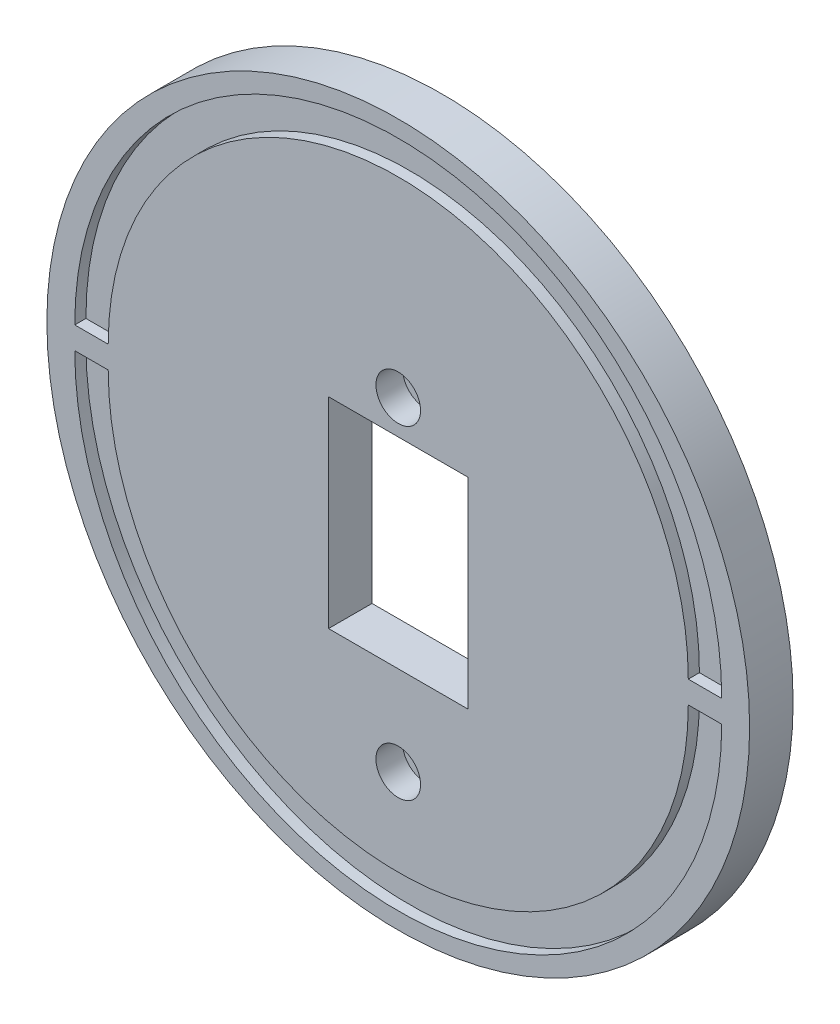
from build123d import *

# Parameters (mm, degrees)
CROQUIS1_R              = 31.5
SALIENTE_EXTRUIR1_DEPTH = 2.4
CROQUIS2_W              = 16.1
CROQUIS2_H              = 36.6
CROQUIS2_W_2            = 12.5
CROQUIS2_H_2            = 33
SALIENTE_EXTRUIR2_DEPTH = 22.5
CROQUIS5_W              = 16.1
CROQUIS5_H              = 36.6
CORTAR_EXTRUIR2_DEPTH   = 9
CROQUIS6_R              = 1.5
CORTAR_EXTRUIR3_DEPTH   = 2.4
CROQUIS7_W              = 12.5
CROQUIS7_H              = 9
SALIENTE_EXTRUIR3_DEPTH = 33
CROQUIS8_R              = 1
CORTAR_EXTRUIR5_DEPTH   = 9
SALIENTE_EXTRUIR4_DEPTH = 12.5
CROQUIS10_W             = 4
CROQUIS10_H             = 2
CORTAR_EXTRUIR6_DEPTH   = 9
CROQUIS11_R             = 31.5
CROQUIS11_W             = 12.5
CROQUIS11_H             = 18
SALIENTE_EXTRUIR5_DEPTH = 3.9
CORTAR_EXTRUIR7_START   = 7
CROQUIS12_R             = 1
CORTAR_EXTRUIR7_DEPTH   = 3.9
CROQUIS13_R             = 2
CORTAR_EXTRUIR8_DEPTH   = 2.4
CROQUIS14_R             = 31.5
CORTAR_EXTRUIR9_DEPTH   = 24.9
CROQUIS15_R             = 31.5
CROQUIS15_R_2           = 2
CROQUIS15_W             = 12.5
CROQUIS15_H             = 18
SALIENTE_EXTRUIR6_DEPTH = 1
CORTAR_EXTRUIR10_DEPTH  = 2
CROQUIS17_R             = 31.5
CORTAR_EXTRUIR11_DEPTH  = 1


with BuildPart() as part:
    # Croquis1 → Saliente-Extruir1 (new body)
    with BuildSketch(Plane.XY):
        with Locations((-51.235671923, 9.786589019)):
            Circle(CROQUIS1_R)
    extrude(amount=SALIENTE_EXTRUIR1_DEPTH)

    # Croquis2 → Saliente-Extruir2 (add)
    with BuildSketch(Plane.XY.offset(2.4)):
        with Locations((-51.235671923, 5.086589019)):
            Rectangle(CROQUIS2_W, CROQUIS2_H)
        with Locations((-51.235671923, 5.086589019)):
            Rectangle(CROQUIS2_W_2, CROQUIS2_H_2, mode=Mode.SUBTRACT)
    extrude(amount=SALIENTE_EXTRUIR2_DEPTH)

    # Croquis5 → Cortar-Extruir2 (cut)
    with BuildSketch(Plane.XY.offset(2.4)):
        with Locations((-51.235671923, 5.086589019)):
            Rectangle(CROQUIS5_W, CROQUIS5_H)
    extrude(amount=-CORTAR_EXTRUIR2_DEPTH, mode=Mode.SUBTRACT)


with BuildPart() as cortar_extruir2_piece_1:
    # of the separate pieces the step leaves, piece 1, a body of its own (cortar_extruir2_pieces)
    add(part.part.solids().sort_by_distance((-19.735671923, 9.786589019, 0))[0])

    # Croquis6 → Cortar-Extruir3 (cut)
    with BuildSketch(Plane(origin=(0, 0, 0), x_dir=(-1, 0, 0), z_dir=(0, 0, -1))):
        with Locations((34.618662565, 26.403598377)):
            Circle(CROQUIS6_R)
        with Locations((67.85268128, 26.403598377)):
            Circle(CROQUIS6_R)
        with Locations((67.85268128, -6.830420339)):
            Circle(CROQUIS6_R)
        with Locations((34.618662565, -6.830420339)):
            Circle(CROQUIS6_R)
        Polygon((51.235671923, 23.386589019), (53.235671923, 23.386589019), (53.235671923, 43.386589019), (49.235671923, 43.386589019), (49.235671923, 23.386589019), align=None)
    extrude(amount=-CORTAR_EXTRUIR3_DEPTH, mode=Mode.SUBTRACT)


with BuildPart() as cortar_extruir2_piece_2:
    # of the separate pieces the step leaves, piece 2, a body of its own (cortar_extruir2_pieces)
    add(part.part.solids().sort_by_distance((-59.285671923, -13.213410981, 24.9))[0])

    # Croquis7 → Saliente-Extruir3 (add)
    with BuildSketch(Plane.XZ.offset(-21.586589019)):
        with Locations((-51.235671923, 13.4)):
            Rectangle(CROQUIS7_W, CROQUIS7_H)
    extrude(amount=SALIENTE_EXTRUIR3_DEPTH)

    # Croquis8 → Cortar-Extruir5 (cut)
    with BuildSketch(Plane.XY.offset(17.9)):
        with Locations((-51.235671923, -9.413410981)):
            Circle(CROQUIS8_R)
        with Locations((-51.235671923, 19.636589019)):
            Circle(CROQUIS8_R)
        Polygon((-44.985671923, -6.413410981), (-57.485671923, -6.413410981), (-57.485671923, 16.586589019), (-53.235671923, 16.586589019), (-53.235671923, 18.586589019), (-49.235671923, 18.586589019), (-49.235671923, 16.586589019), (-44.985671923, 16.586589019), align=None)
    extrude(amount=-CORTAR_EXTRUIR5_DEPTH, mode=Mode.SUBTRACT)

    # Croquis9 → Saliente-Extruir4 (add)
    with BuildSketch(Plane.ZY.offset(44.985671923)):
        Polygon((8.9, -6.413410981), (3.9, -11.413410981), (8.9, -11.413410981), align=None)
        Polygon((8.9, 16.586589019), (3.9, 21.586589019), (8.9, 21.586589019), align=None)
    extrude(amount=SALIENTE_EXTRUIR4_DEPTH)

    # Croquis10 → Cortar-Extruir6 (cut)
    with BuildSketch(Plane.XY.offset(8.9)):
        with Locations((-51.235671923, 17.586589019)):
            Rectangle(CROQUIS10_W, CROQUIS10_H)
    extrude(amount=-CORTAR_EXTRUIR6_DEPTH, mode=Mode.SUBTRACT)

    # Croquis11 → Saliente-Extruir5 (add)
    with BuildSketch(Plane.XY.offset(24.9)):
        with Locations((-51.235671923, 9.786589019)):
            Circle(CROQUIS11_R)
        with Locations((-51.235671923, 7.586589019)):
            Rectangle(CROQUIS11_W, CROQUIS11_H, mode=Mode.SUBTRACT)
    extrude(amount=SALIENTE_EXTRUIR5_DEPTH)

    # Croquis12 → Cortar-Extruir7 (cut)
    with BuildSketch(Plane.XY.offset(17.9).offset(CORTAR_EXTRUIR7_START)):
        with Locations((-51.235671923, 19.636589019)):
            Circle(CROQUIS12_R)
        with Locations((-51.235671923, -9.413410981)):
            Circle(CROQUIS12_R)
    extrude(amount=CORTAR_EXTRUIR7_DEPTH, mode=Mode.SUBTRACT)

    # Croquis13 → Cortar-Extruir8 (cut)
    with BuildSketch(Plane.XY.offset(28.8)):
        with Locations((-51.235671923, 19.636589019)):
            Circle(CROQUIS13_R)
        with Locations((-51.235671923, -9.413410981)):
            Circle(CROQUIS13_R)
    extrude(amount=-CORTAR_EXTRUIR8_DEPTH, mode=Mode.SUBTRACT)


with BuildPart() as cortar_extruir9_tool:
    # Croquis14 → Cortar-Extruir9 (new body)
    with BuildSketch(Plane(origin=(0, 0, 0), x_dir=(-1, 0, 0), z_dir=(0, 0, -1))):
        with Locations(Location((51.235671923, 9.786589019, 0), (0, 0, 180))):
            Circle(CROQUIS14_R)
    extrude(amount=-CORTAR_EXTRUIR9_DEPTH)


with BuildPart() as cortar_extruir2_piece_1_1:
    add(cortar_extruir2_piece_1.part)

    # Cortar-Extruir9: cut by cortar_extruir9_tool
    add(cortar_extruir9_tool.part, mode=Mode.SUBTRACT)


with BuildPart() as cortar_extruir2_piece_2_1:
    add(cortar_extruir2_piece_2.part)

    # Cortar-Extruir9: cut by cortar_extruir9_tool
    add(cortar_extruir9_tool.part, mode=Mode.SUBTRACT)

    # Croquis15 → Saliente-Extruir6 (add)
    with BuildSketch(Plane.XY.offset(28.8)):
        with Locations((-51.235671923, 9.786589019)):
            Circle(CROQUIS15_R)
        with Locations((-51.235671923, 19.636589019)):
            Circle(CROQUIS15_R_2, mode=Mode.SUBTRACT)
        with Locations((-51.235671923, -9.413410981)):
            Circle(CROQUIS15_R_2, mode=Mode.SUBTRACT)
        with Locations((-51.235671923, 7.586589019)):
            Rectangle(CROQUIS15_W, CROQUIS15_H, mode=Mode.SUBTRACT)
    extrude(amount=SALIENTE_EXTRUIR6_DEPTH)

    # Croquis16 → Cortar-Extruir10 (cut)
    with BuildSketch(Plane.XY.offset(29.8)):
        with BuildLine():
            Line((-22.235671923, 8.786589019), (-25.235671923, 8.786589019))
            ThreePointArc((-25.235671923, 8.786589019), (-51.235671923, -17.213410981), (-77.235671923, 8.786589019))
            Line((-77.235671923, 8.786589019), (-80.235671923, 8.786589019))
            ThreePointArc((-80.235671923, 8.786589019), (-51.235671923, -20.213410981), (-22.235671923, 8.786589019))
        make_face()
        with BuildLine():
            Line((-22.235671923, 10.786589019), (-25.235671923, 10.786589019))
            ThreePointArc((-25.235671923, 10.786589019), (-51.235671923, 36.786589019), (-77.235671923, 10.786589019))
            Line((-77.235671923, 10.786589019), (-80.235671923, 10.786589019))
            ThreePointArc((-80.235671923, 10.786589019), (-51.235671923, 39.786589019), (-22.235671923, 10.786589019))
        make_face()
    extrude(amount=-CORTAR_EXTRUIR10_DEPTH, mode=Mode.SUBTRACT)

    # Croquis17 → Cortar-Extruir11 (cut)
    with BuildSketch(Plane.XY.offset(29.8)):
        with Locations((-51.235671923, 9.786589019)):
            Circle(CROQUIS17_R)
    extrude(amount=-CORTAR_EXTRUIR11_DEPTH, mode=Mode.SUBTRACT)


solid = cortar_extruir2_piece_2_1.part
